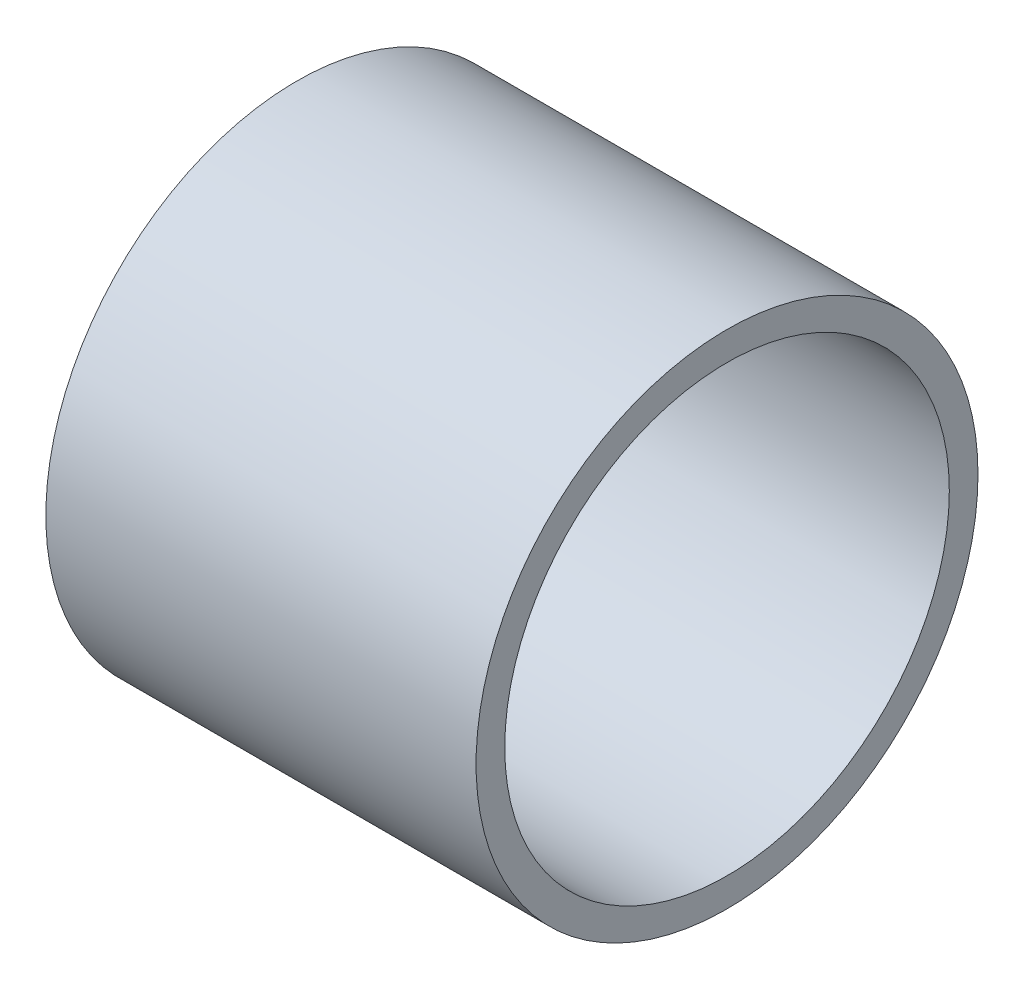
from build123d import *

# Parameters (mm, degrees)
SKETCH_1_R      = 35
SKETCH_1_R_2    = 31
EXTRUDE_1_DEPTH = 60


with BuildPart() as part:
    # 草图1 → 凸台-拉伸1 (new body)
    with BuildSketch(Plane(origin=(0, 0, 0), x_dir=(0, 0, -1), z_dir=(1, 0, 0))):
        Circle(SKETCH_1_R)
        Circle(SKETCH_1_R_2, mode=Mode.SUBTRACT)
    extrude(amount=EXTRUDE_1_DEPTH)


solid = part.part
